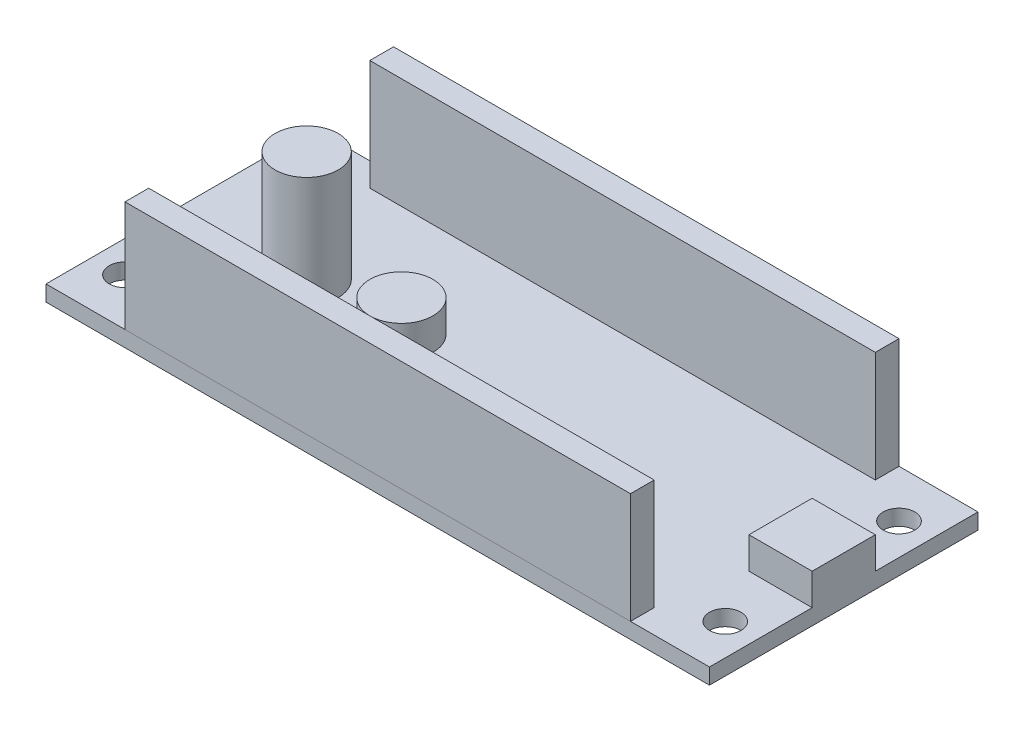
from build123d import *

# Parameters (mm, degrees)
SKETCH1_W             = 66.675
SKETCH1_H             = 26.9875
BOSS_EXTRUDE1_DEPTH   = 1.5875
SKETCH2_R             = 3.175
BOSS_EXTRUDE2_DEPTH   = 11.1125
SKETCH2_W             = 50.8
SKETCH2_H             = 2.38125
BOSS_EXTRUDE2_2_DEPTH = 11.1125
BOSS_EXTRUDE2_3_DEPTH = 11.1125
SKETCH3_R             = 3.175
SKETCH3_W             = 6.35
SKETCH3_H             = 6.35
BOSS_EXTRUDE3_DEPTH   = 3.175
SKETCH4_R             = 1.5875
CUT_EXTRUDE1_DEPTH    = 38.642500602


with BuildPart() as part:
    # Sketch1 → Boss-Extrude1 (new body)
    with BuildSketch(Plane(origin=(0, 0, 0), x_dir=(1, 0, 0), z_dir=(0, 1, 0))):
        Rectangle(SKETCH1_W, SKETCH1_H)
    extrude(amount=BOSS_EXTRUDE1_DEPTH)

    # Sketch3 → Boss-Extrude3 (add)
    with BuildSketch(Plane(origin=(0, 1.5875, 0), x_dir=(1, 0, 0), z_dir=(0, 1, 0))):
        with Locations(Location((-11.1125, 0, 0), (0, 0, 270))):
            Circle(SKETCH3_R)
        with Locations((30.1625, 0)):
            Rectangle(SKETCH3_W, SKETCH3_H)
    extrude(amount=BOSS_EXTRUDE3_DEPTH)

    # Sketch4 → Cut-Extrude1 (cut, through all)
    with BuildSketch(Plane(origin=(0, 1.5875, 0), x_dir=(1, 0, 0), z_dir=(0, 1, 0))):
        with Locations(Location((30.1625, -8.73125, 0), (0, 0, 270))):
            Circle(SKETCH4_R)
        with Locations(Location((30.1625, 8.73125, 0), (0, 0, 270))):
            Circle(SKETCH4_R)
        with Locations(Location((-30.1625, 8.73125, 0), (0, 0, 270))):
            Circle(SKETCH4_R)
        with Locations(Location((-30.1625, -8.73125, 0), (0, 0, 270))):
            Circle(SKETCH4_R)
    extrude(amount=-CUT_EXTRUDE1_DEPTH, mode=Mode.SUBTRACT)


with BuildPart() as body_2:
    # Sketch2 → Boss-Extrude2 (new body)
    with BuildSketch(Plane(origin=(0, 1.5875, 0), x_dir=(1, 0, 0), z_dir=(0, 1, 0))):
        with Locations(Location((-20.6375, 0, 0), (0, 0, 270))):
            Circle(SKETCH2_R)
    extrude(amount=BOSS_EXTRUDE2_DEPTH)


with BuildPart() as body_3:
    # Sketch2 → Boss-Extrude2 2 (new body)
    with BuildSketch(Plane(origin=(0, 1.5875, 0), x_dir=(1, 0, 0), z_dir=(0, 1, 0))):
        with Locations((0, 12.303125)):
            Rectangle(SKETCH2_W, SKETCH2_H)
    extrude(amount=BOSS_EXTRUDE2_2_DEPTH)


with BuildPart() as body_4:
    # Sketch2 → Boss-Extrude2 3 (new body)
    with BuildSketch(Plane(origin=(0, 1.5875, 0), x_dir=(1, 0, 0), z_dir=(0, 1, 0))):
        with Locations((0, -12.303125)):
            Rectangle(SKETCH2_W, SKETCH2_H)
    extrude(amount=BOSS_EXTRUDE2_3_DEPTH)


solid = Compound([part.part, body_2.part, body_3.part, body_4.part])
